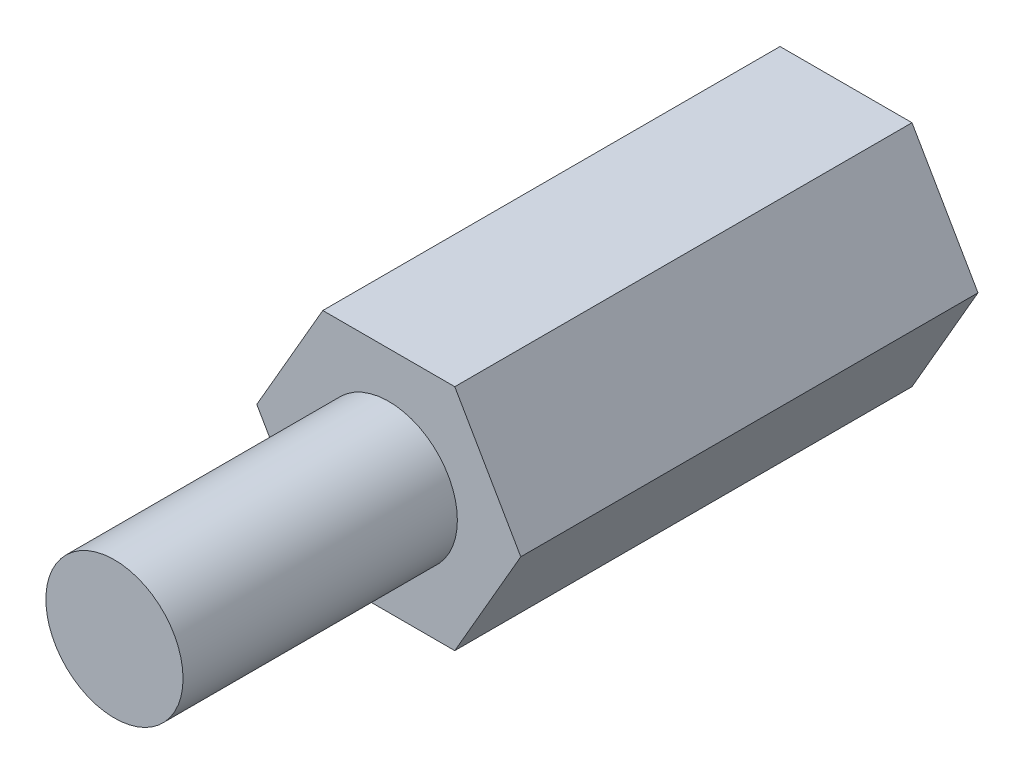
from build123d import *

# Parameters (mm, degrees)
BOSS_EXTRUDE1_DEPTH       = 10
SKETCH2_R                 = 1.5
BOSS_EXTRUDE2_DEPTH       = 6
M3X0_5_TAPPED_HOLE1_D     = 2.5
M3X0_5_TAPPED_HOLE1_DEPTH = 8
M3X0_5_TAPPED_HOLE1_TIP   = 0.751075774


with BuildPart() as part:
    # Sketch1 → Boss-Extrude1 (new body)
    with BuildSketch(Plane.XY):
        Polygon((-1.443375673, 2.5), (-2.886751346, 0), (-1.443375673, -2.5), (1.443375673, -2.5), (2.886751346, 0), (1.443375673, 2.5), align=None)
    extrude(amount=BOSS_EXTRUDE1_DEPTH)

    # Sketch2 → Boss-Extrude2 (add)
    with BuildSketch(Plane.XY.offset(10)):
        Circle(SKETCH2_R)
    extrude(amount=BOSS_EXTRUDE2_DEPTH)

    # M3x0.5 Tapped Hole1
    with Locations(Plane(origin=(0, 0, 0), x_dir=(-1, 0, 0), z_dir=(0, 0, -1))):
        with Locations((0, 0)):
            Hole(M3X0_5_TAPPED_HOLE1_D / 2, depth=M3X0_5_TAPPED_HOLE1_DEPTH)
            with Locations((0, 0, -(M3X0_5_TAPPED_HOLE1_DEPTH + M3X0_5_TAPPED_HOLE1_TIP / 2))):  # 118° drill point
                Cone(0, M3X0_5_TAPPED_HOLE1_D / 2, M3X0_5_TAPPED_HOLE1_TIP, mode=Mode.SUBTRACT)


solid = part.part
